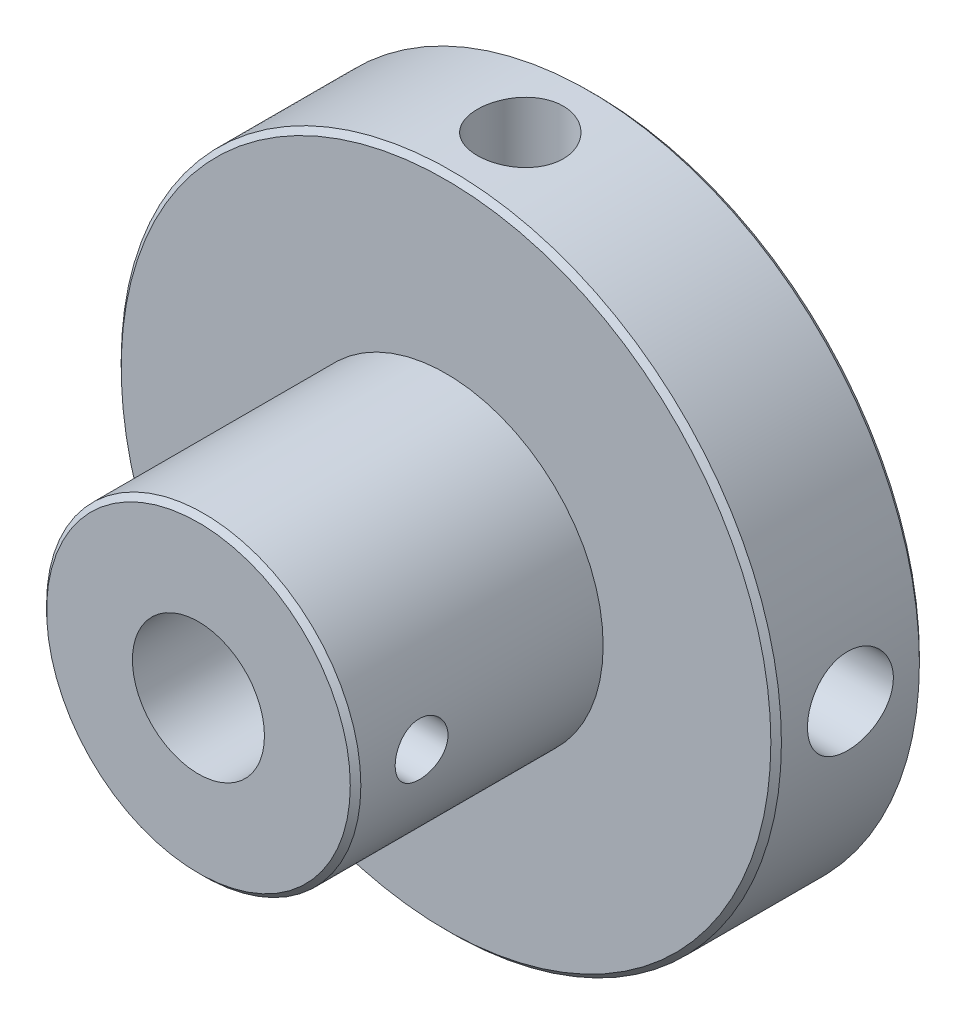
from build123d import *

# Parameters (mm, degrees)
SKETCH1_R           = 31.75
BASE_EXTRUDE_DEPTH  = 14.2875
SKETCH2_R           = 15.113
BOSS_EXTRUDE1_DEPTH = 38.1
SKETCH3_R           = 6.35
CUT_EXTRUDE1_DEPTH  = 77.724
SKETCH5_R           = 2.54
CUT_EXTRUDE3_DEPTH  = 37.846
SKETCH6_R           = 4.1275
CUT_EXTRUDE4_DEPTH  = 25.8572
SKETCH7_R           = 4.1275
CUT_EXTRUDE5_DEPTH  = 15.24
SKETCH8_R           = 4.1275
CUT_EXTRUDE6_DEPTH  = 26.51
SKETCH9_R           = 4.1275
CUT_EXTRUDE7_DEPTH  = 10.508
CHAMFER1_SIZE       = 0.508


with BuildPart() as part:
    # Sketch1 → Base-Extrude (new body)
    with BuildSketch(Plane.XY):
        Circle(SKETCH1_R)
    extrude(amount=BASE_EXTRUDE_DEPTH)

    # Sketch2 → Boss-Extrude1 (add)
    with BuildSketch(Plane.XY):
        with Locations(Location((0, 0, 0), (0, 0, 180))):
            Circle(SKETCH2_R)
    extrude(amount=BOSS_EXTRUDE1_DEPTH)

    # Sketch3 → Cut-Extrude1 (cut)
    with BuildSketch(Plane.XY):
        with Locations(Location((0, 0, 0), (0, 0, 180))):
            Circle(SKETCH3_R)
    extrude(amount=CUT_EXTRUDE1_DEPTH, mode=Mode.SUBTRACT)

    # Sketch5 → Cut-Extrude3 (cut)
    with BuildSketch(Plane(origin=(38.336621827, 0, 0), x_dir=(0, 0, -1), z_dir=(1, 0, 0))):
        with Locations((-31.75, 0)):
            Circle(SKETCH5_R)
    extrude(amount=-CUT_EXTRUDE3_DEPTH, mode=Mode.SUBTRACT)

    # Sketch6 → Cut-Extrude4 (cut)
    with BuildSketch(Plane(origin=(38.336621827, 0, 0), x_dir=(0, 0, -1), z_dir=(1, 0, 0))):
        with Locations((-7.14375, 0)):
            Circle(SKETCH6_R)
    cut_extrude4 = extrude(amount=-CUT_EXTRUDE4_DEPTH, mode=Mode.SUBTRACT)

    # Sketch7 → Cut-Extrude5 (cut)
    with BuildSketch(Plane(origin=(0, 27.700210809, 0), x_dir=(-1, 0, 0), z_dir=(0, 1, 0))):
        with Locations(Location((0, 7.14375, 0), (0, 0, 90))):
            Circle(SKETCH7_R)
    cut_extrude5 = extrude(amount=-CUT_EXTRUDE5_DEPTH, mode=Mode.SUBTRACT)

    # Mirror1: Cut-Extrude4 across plane
    add(cut_extrude4.mirror(Plane(origin=(0, 0, 0), x_dir=(0, 0, 1), z_dir=(1, 0, 0))), mode=Mode.SUBTRACT)

    # Mirror2: Cut-Extrude5 across plane
    add(cut_extrude5.mirror(Plane.ZX), mode=Mode.SUBTRACT)

    # Sketch8 → Cut-Extrude6 (cut)
    with BuildSketch(Plane(origin=(0, 27.700210809, 0), x_dir=(-1, 0, 0), z_dir=(0, 1, 0))):
        with Locations(Location((0, 7.14375, 0), (0, 0, 90))):
            Circle(SKETCH8_R)
    extrude(amount=CUT_EXTRUDE6_DEPTH, mode=Mode.SUBTRACT)

    # Sketch9 → Cut-Extrude7 (cut)
    with BuildSketch(Plane(origin=(0, -34.128089617, 0), x_dir=(-1, 0, 0), z_dir=(0, 1, 0))):
        with Locations(Location((0, 7.14375, 0), (0, 0, 270))):
            Circle(SKETCH9_R)
    extrude(amount=CUT_EXTRUDE7_DEPTH, mode=Mode.SUBTRACT)

    # Chamfer1
    chamfer1_edges = [part.edges().sort_by_distance(p)[0] for p in [
        (6.35, 0, 0),
        (-31.75, 0, 0),
        (-31.75, 0, 14.2875),
        (15.113, 0, 38.1),
    ]]
    chamfer(chamfer1_edges, length=CHAMFER1_SIZE)


solid = part.part
